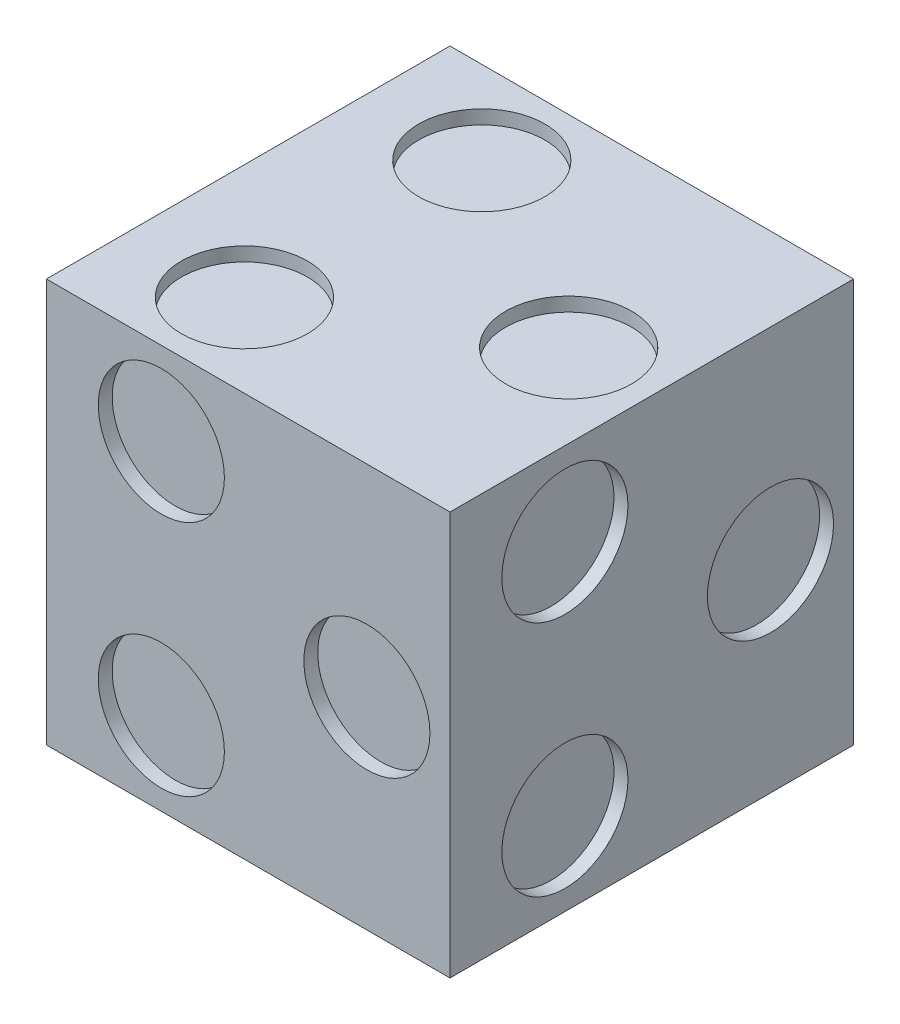
from build123d import *

# Parameters (mm, degrees)
SKETCH1_W           = 101.6
SKETCH1_H           = 101.6
BOSS_EXTRUDE2_DEPTH = 101.6
SKETCH3_R           = 15.875
CUT_EXTRUDE1_DEPTH  = 3.500000112
SKETCH4_R           = 15.875
CUT_EXTRUDE2_DEPTH  = 3.500000112
SKETCH5_R           = 15.875
CUT_EXTRUDE3_DEPTH  = 3.500000112
SKETCH6_R           = 15.875
CUT_EXTRUDE4_DEPTH  = 3.500000112
SKETCH7_R           = 15.875
CUT_EXTRUDE5_DEPTH  = 3.500000112
SKETCH8_R           = 15.875
CUT_EXTRUDE6_DEPTH  = 3.500000112


with BuildPart() as part:
    # Sketch1 → Boss-Extrude2 (new body)
    with BuildSketch(Plane(origin=(0, 0, 0), x_dir=(1, 0, 0), z_dir=(0, 1, 0))):
        with Locations((50.8, 50.8)):
            Rectangle(SKETCH1_W, SKETCH1_H)
    extrude(amount=BOSS_EXTRUDE2_DEPTH)

    # Sketch3 → Cut-Extrude1 (cut)
    with BuildSketch(Plane(origin=(0, 101.6, 0), x_dir=(1, 0, 0), z_dir=(0, 1, 0))):
        with Locations(Location((28.927876431, 20.922123569, 0), (0, 0, 270))):
            Circle(SKETCH3_R)
        with Locations(Location((28.927876431, 80.677876431, 0), (0, 0, 270))):
            Circle(SKETCH3_R)
        with Locations(Location((80.677876431, 50.8, 0), (0, 0, 270))):
            Circle(SKETCH3_R)
    extrude(amount=-CUT_EXTRUDE1_DEPTH, mode=Mode.SUBTRACT)

    # Sketch4 → Cut-Extrude2 (cut)
    with BuildSketch(Plane.ZY):
        with Locations((-72.672123569, 20.922123569)):
            Circle(SKETCH4_R)
        with Locations((-72.672123569, 80.677876431)):
            Circle(SKETCH4_R)
        with Locations((-20.922123569, 50.8)):
            Circle(SKETCH4_R)
    extrude(amount=-CUT_EXTRUDE2_DEPTH, mode=Mode.SUBTRACT)

    # Sketch5 → Cut-Extrude3 (cut)
    with BuildSketch(Plane(origin=(0, 0, -101.6), x_dir=(-1, 0, 0), z_dir=(0, 0, -1))):
        with Locations((-72.672123569, 20.922123569)):
            Circle(SKETCH5_R)
        with Locations((-72.672123569, 80.677876431)):
            Circle(SKETCH5_R)
        with Locations((-20.922123569, 50.8)):
            Circle(SKETCH5_R)
    extrude(amount=-CUT_EXTRUDE3_DEPTH, mode=Mode.SUBTRACT)

    # Sketch6 → Cut-Extrude4 (cut)
    with BuildSketch(Plane(origin=(101.6, 0, 0), x_dir=(0, 0, -1), z_dir=(1, 0, 0))):
        with Locations((28.927876431, 20.922123569)):
            Circle(SKETCH6_R)
        with Locations((28.927876431, 80.677876431)):
            Circle(SKETCH6_R)
        with Locations((80.677876431, 50.8)):
            Circle(SKETCH6_R)
    extrude(amount=-CUT_EXTRUDE4_DEPTH, mode=Mode.SUBTRACT)

    # Sketch7 → Cut-Extrude5 (cut)
    with BuildSketch(Plane.XY):
        with Locations((28.927876431, 20.922123569)):
            Circle(SKETCH7_R)
        with Locations((28.927876431, 80.677876431)):
            Circle(SKETCH7_R)
        with Locations((80.677876431, 50.8)):
            Circle(SKETCH7_R)
    extrude(amount=-CUT_EXTRUDE5_DEPTH, mode=Mode.SUBTRACT)

    # Sketch8 → Cut-Extrude6 (cut)
    with BuildSketch(Plane(origin=(0, 0, 0), x_dir=(-1, 0, 0), z_dir=(0, -1, 0))):
        with Locations(Location((-72.672123569, 20.922123569, 0), (0, 0, 90))):
            Circle(SKETCH8_R)
        with Locations(Location((-72.672123569, 80.677876431, 0), (0, 0, 90))):
            Circle(SKETCH8_R)
        with Locations(Location((-20.922123569, 50.8, 0), (0, 0, 90))):
            Circle(SKETCH8_R)
    extrude(amount=-CUT_EXTRUDE6_DEPTH, mode=Mode.SUBTRACT)


solid = part.part
